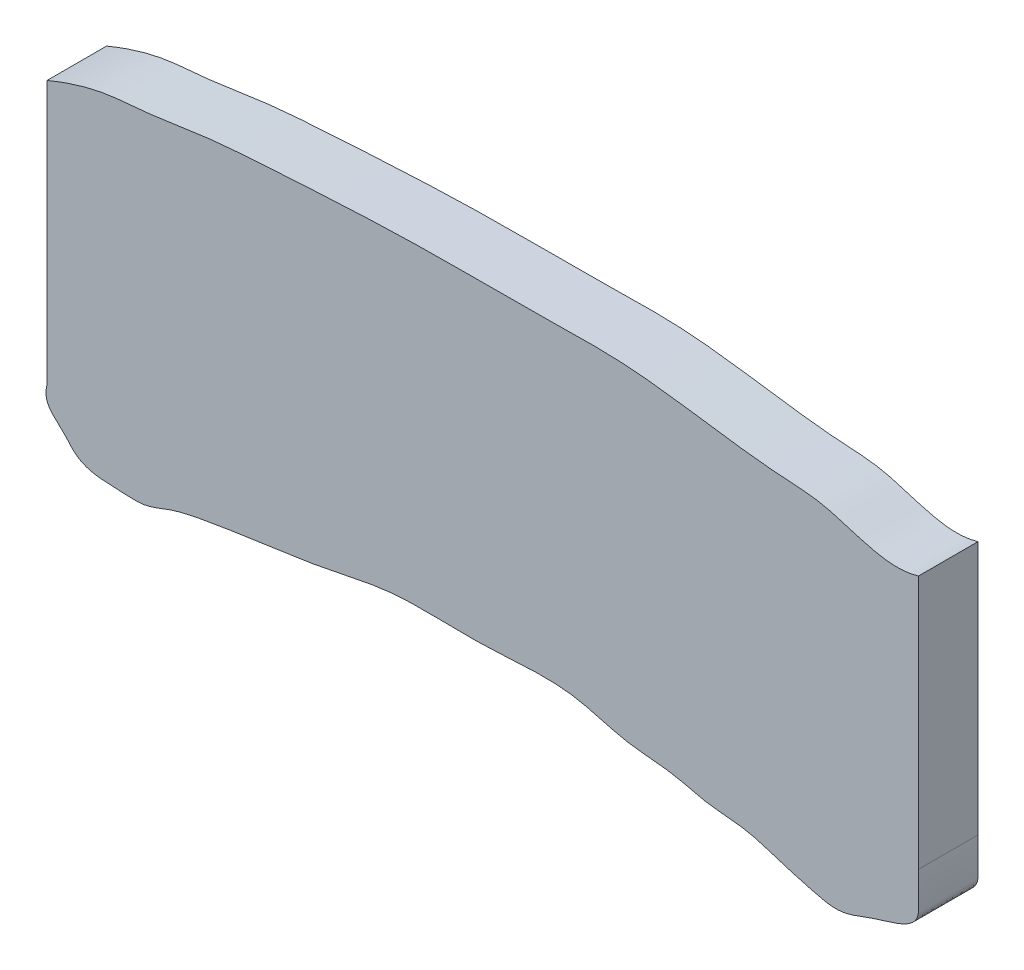
from build123d import *

# Parameters (mm, degrees)
EXTRUDE1_DEPTH = 3.8


with BuildPart() as part:
    # Sketch1 → Extrude1 (new body)
    with BuildSketch(Plane.XY):
        with BuildLine():
            Line((-13.257101377, 28.258538753), (-13.257101377, 12.043408806))
            add(Edge.make_bspline(
                [(-68.877644788, 11.02256294), (-69.180133174, 9.888868663), (-68.038544697, 9.318753971), (-67.160738855, 8.075641987), (-65.952525838, 7.51272839), (-64.434992733, 7.535702615), (-62.655548043, 7.327670341), (-61.218107736, 8.016591429), (-59.579889283, 8.442472011), (-57.597663147, 8.762793), (-54.843457294, 9.199480193), (-51.192495426, 9.641768165), (-47.468087597, 10.621874176), (-43.816428485, 10.581637676), (-39.918379973, 10.506664676), (-35.793457679, 11.055169938), (-31.976940875, 9.64438232), (-29.138262344, 9.62129142), (-26.66929144, 8.853142808), (-24.241570465, 8.849038989), (-22.111974798, 8.044093176), (-20.240055082, 7.558284701), (-18.215129191, 6.984286524), (-16.035550202, 8.093667845), (-13.185558526, 8.604587393), (-13.289243986, 10.585395842), (-13.233264232, 11.354396414), (-13.257101377, 12.043408806)],
                knots=[0, 0, 0, 0, 0.040133644, 0.058142927, 0.073417747, 0.103139508, 0.132113339, 0.159260984, 0.179308237, 0.215301268, 0.257644741, 0.316224866, 0.395793982, 0.445168469, 0.494531293, 0.587891417, 0.644114329, 0.69056874, 0.725720092, 0.77004335, 0.808074284, 0.835933706, 0.866455948, 0.905517555, 0.960777612, 0.966811825, 1, 1, 1, 1], degree=3))
            Line((-68.877644788, 11.02256294), (-68.877644788, 27.846254328))
            add(Edge.make_bspline(
                [(-68.877644788, 27.846254328), (-67.78111006, 28.299111994), (-65.57956443, 29.069387663), (-62.229666819, 29.20692175), (-59.007671534, 29.796406633), (-55.484765341, 30.06783613), (-51.026003458, 30.331625464), (-44.711683338, 30.641257733), (-38.348918542, 30.536846419), (-30.374024425, 30.768039627), (-24.70728443, 29.467256712), (-18.18351894, 29.253879384), (-15.497435651, 27.60472604), (-13.257101377, 28.258538753)],
                knots=[0, 0, 0, 0, 0.063690703, 0.123157575, 0.178342062, 0.238803917, 0.31199743, 0.417417467, 0.576851348, 0.652664206, 0.843232687, 0.885213231, 1, 1, 1, 1], degree=3))
        make_face()
    extrude(amount=EXTRUDE1_DEPTH)


solid = part.part
